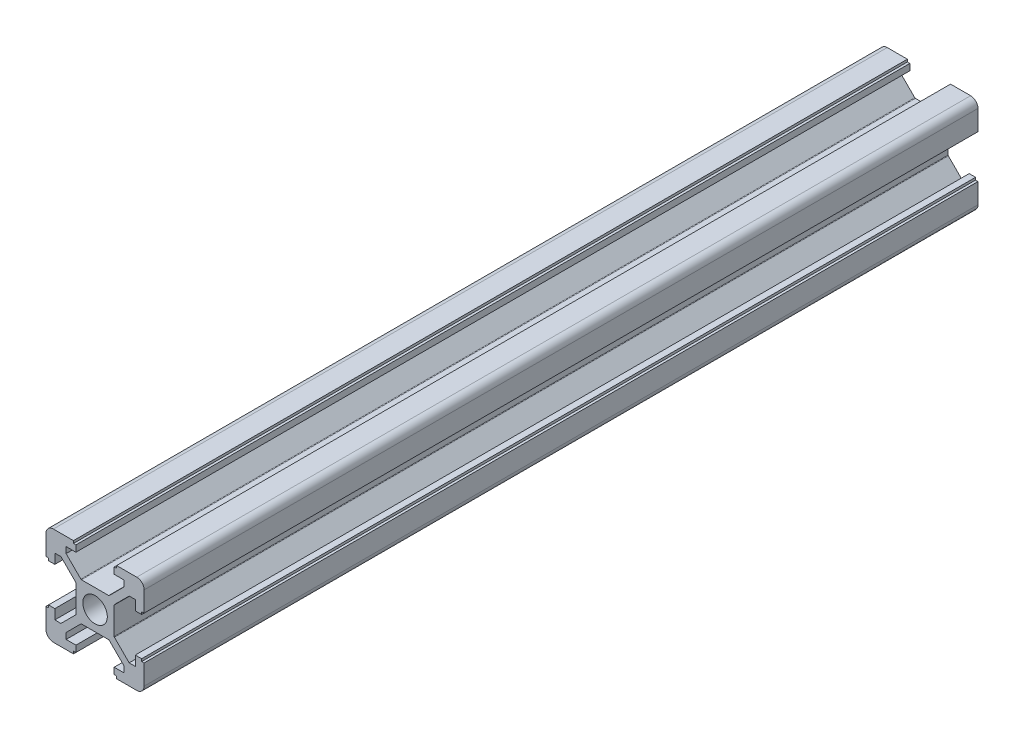
from build123d import *

# Parameters (mm, degrees)
SKETCH_1_R      = 2.5
EXTRUDE_1_DEPTH = 170
FILLET_1_R      = 1.5
FILLET_2_R      = 0.2


with BuildPart() as part:
    # 草图1 → 凸台-拉伸1 (new body)
    with BuildSketch(Plane.XY):
        Polygon((-9.999999566, 9.999999566), (-4.399999566, 9.999999566), (-4.399999566, 9.499999566), (-3.899999566, 9.499999566), (-3.899999566, 8.199999566), (-5.899999566, 8.199999566), (-5.899999566, 6.960659737), (-2.839609534, 3.900132646), (2.839471605, 3.900132646), (5.900000434, 6.960661475), (5.900000434, 8.200001303), (3.900000434, 8.200001303), (3.900000434, 9.500001303), (4.400000434, 9.500001303), (4.400000434, 10.000001303), (10.000000434, 10.000001303), (10.000000434, 4.400001303), (9.500000434, 4.400001303), (9.500000434, 3.900001303), (8.200000434, 3.900001303), (8.200000434, 5.900001303), (6.960660606, 5.900001303), (3.900133515, 2.839611272), (3.900133515, -2.839469868), (6.960662344, -5.899998697), (8.200002172, -5.899998697), (8.200002172, -3.899998697), (9.500002172, -3.899998697), (9.500002172, -4.399998697), (10.000002172, -4.399998697), (10.000000434, -10.000000434), (4.400002172, -9.999998697), (4.400002172, -9.499998697), (3.900002172, -9.499998697), (3.900002172, -8.199998697), (5.900002172, -8.199998697), (5.900002172, -6.960658869), (2.839475081, -3.899994711), (-2.839331933, -3.899994711), (-5.899997828, -6.960660606), (-5.899997828, -8.200000434), (-3.899997828, -8.200000434), (-3.899997828, -9.500000434), (-4.399997828, -9.500000434), (-4.399997828, -10.000000434), (-9.999999566, -10.000000434), (-9.999997828, -4.400000434), (-9.499997828, -4.400000434), (-9.499997828, -3.900000434), (-8.199997828, -3.900000434), (-8.199997828, -5.900000434), (-6.960658, -5.900000434), (-3.899993842, -2.839473343), (-3.899993842, 2.83933367), (-6.960659737, 5.899999566), (-8.199999566, 5.899999566), (-8.199999566, 3.899999566), (-9.499999566, 3.899999566), (-9.499999566, 4.399999566), (-9.999999566, 4.399999566), align=None)
        Circle(SKETCH_1_R, mode=Mode.SUBTRACT)
    extrude(amount=EXTRUDE_1_DEPTH)

    # 圆角1
    fillet_1_edges = [part.edges().sort_by_distance(p)[0] for p in [
        (10.000000434, 10.000001303, 85),
        (10.000000434, -10.000000434, 85),
        (-9.999999566, -10.000000434, 85),
        (-9.999999566, 9.999999566, 85),
    ]]
    fillet(fillet_1_edges, radius=FILLET_1_R)

    # 圆角2
    fillet_2_edges = [part.edges().sort_by_distance(p)[0] for p in [
        (3.900133515, 2.839611272, 85),
        (3.900133515, -2.839469868, 85),
        (2.839475081, -3.899994711, 85),
        (-2.839331933, -3.899994711, 85),
        (-3.899993842, -2.839473343, 85),
        (-3.899993842, 2.83933367, 85),
        (-2.839609534, 3.900132646, 85),
        (2.839471605, 3.900132646, 85),
    ]]
    fillet(fillet_2_edges, radius=FILLET_2_R)


solid = part.part
